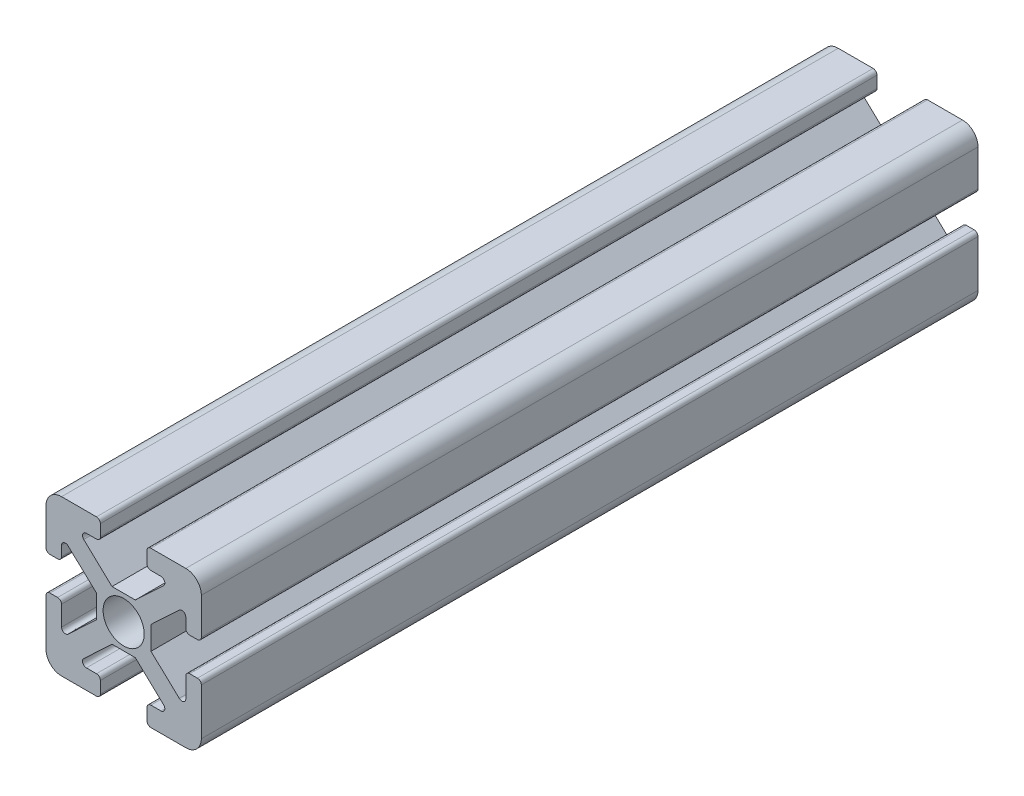
from build123d import *

# Parameters (mm, degrees)
SKETCH1_R           = 2.65
BOSS_EXTRUDE2_DEPTH = 100


with BuildPart() as part:
    # Sketch1 → Boss-Extrude2 (new body)
    with BuildSketch(Plane.XY):
        with BuildLine():
            Line((0, 2), (0, 8.007512652))
            ThreePointArc((0, 8.007512652), (0.146446609, 8.361066043), (0.5, 8.507512652))
            Line((0.5, 8.507512652), (1.5, 8.507512652))
            ThreePointArc((1.5, 8.507512652), (1.853553391, 8.361066043), (2, 8.007512652))
            Line((2, 8.007512652), (2, 5.451323229))
            ThreePointArc((2, 5.451323229), (2.301581692, 4.992378598), (2.842520699, 5.087071159))
            Line((2.842520699, 5.087071159), (6.485041399, 8.512278154))
            Line((6.485041399, 8.512278154), (6.485041399, 11.512278154))
            Line((6.485041399, 11.512278154), (2.842520699, 14.937485148))
            ThreePointArc((2.842520699, 14.937485148), (2.301581692, 15.03217771), (2, 14.573233078))
            Line((2, 14.573233078), (2, 13.307512652))
            ThreePointArc((2, 13.307512652), (1.853553391, 12.953959262), (1.5, 12.807512652))
            Line((1.5, 12.807512652), (0.5, 12.807512652))
            ThreePointArc((0.5, 12.807512652), (0.146446609, 12.953959262), (0, 13.307512652))
            Line((0, 13.307512652), (0, 18))
            ThreePointArc((0, 18), (0.585786438, 19.414213562), (2, 20))
            Line((2, 20), (6.5, 20))
            ThreePointArc((6.5, 20), (6.853553391, 19.853553391), (7, 19.5))
            Line((7, 19.5), (7, 18.017502122))
            ThreePointArc((7, 18.017502122), (6.853553391, 17.663948732), (6.5, 17.517502122))
            Line((6.5, 17.517502122), (5.2, 17.517502122))
            ThreePointArc((5.2, 17.517502122), (4.735174207, 17.201722052), (4.857479301, 16.653250052))
            Line((4.857479301, 16.653250052), (8.5, 13.228043058))
            Line((8.5, 13.228043058), (11.5, 13.228043058))
            Line((11.5, 13.228043058), (15.142520699, 16.653250052))
            ThreePointArc((15.142520699, 16.653250052), (15.264825793, 17.201722052), (14.8, 17.517502122))
            Line((14.8, 17.517502122), (13.5, 17.517502122))
            ThreePointArc((13.5, 17.517502122), (13.146446609, 17.663948732), (13, 18.017502122))
            Line((13, 18.017502122), (13, 19.5))
            ThreePointArc((13, 19.5), (13.146446609, 19.853553391), (13.5, 20))
            Line((13.5, 20), (18, 20))
            ThreePointArc((18, 20), (19.414213562, 19.414213562), (20, 18))
            Line((20, 18), (20, 13.307512652))
            ThreePointArc((20, 13.307512652), (19.853553391, 12.953959262), (19.5, 12.807512652))
            Line((19.5, 12.807512652), (18.5, 12.807512652))
            ThreePointArc((18.5, 12.807512652), (18.146446609, 12.953959262), (18, 13.307512652))
            Line((18, 13.307512652), (18, 14.573233078))
            ThreePointArc((18, 14.573233078), (17.698418308, 15.03217771), (17.157479301, 14.937485148))
            Line((17.157479301, 14.937485148), (13.514958601, 11.512278154))
            Line((13.514958601, 11.512278154), (13.514958601, 8.512278154))
            Line((13.514958601, 8.512278154), (17.157479301, 5.087071159))
            ThreePointArc((17.157479301, 5.087071159), (17.698418308, 4.992378598), (18, 5.451323229))
            Line((18, 5.451323229), (18, 8.007512652))
            ThreePointArc((18, 8.007512652), (18.146446609, 8.361066043), (18.5, 8.507512652))
            Line((18.5, 8.507512652), (19.5, 8.507512652))
            ThreePointArc((19.5, 8.507512652), (19.853553391, 8.361066043), (20, 8.007512652))
            Line((20, 8.007512652), (20, 2))
            ThreePointArc((20, 2), (19.414213562, 0.585786438), (18, 0))
            Line((18, 0), (13.5, 0))
            ThreePointArc((13.5, 0), (13.146446609, 0.146446609), (13, 0.5))
            Line((13, 0.5), (13, 2.007054185))
            ThreePointArc((13, 2.007054185), (13.146446609, 2.360607576), (13.5, 2.507054185))
            Line((13.5, 2.507054185), (14.8, 2.507054185))
            ThreePointArc((14.8, 2.507054185), (15.264825793, 2.822834256), (15.142520699, 3.371306255))
            Line((15.142520699, 3.371306255), (11.5, 6.79651325))
            Line((11.5, 6.79651325), (8.5, 6.79651325))
            Line((8.5, 6.79651325), (4.857479301, 3.371306255))
            ThreePointArc((4.857479301, 3.371306255), (4.735174207, 2.822834256), (5.2, 2.507054185))
            Line((5.2, 2.507054185), (6.5, 2.507054185))
            ThreePointArc((6.5, 2.507054185), (6.853553391, 2.360607576), (7, 2.007054185))
            Line((7, 2.007054185), (7, 0.5))
            ThreePointArc((7, 0.5), (6.853553391, 0.146446609), (6.5, 0))
            Line((6.5, 0), (2, 0))
            ThreePointArc((2, 0), (0.585786438, 0.585786438), (0, 2))
        make_face()
        with Locations((10, 10)):
            Circle(SKETCH1_R, mode=Mode.SUBTRACT)
    extrude(amount=BOSS_EXTRUDE2_DEPTH)


solid = part.part
